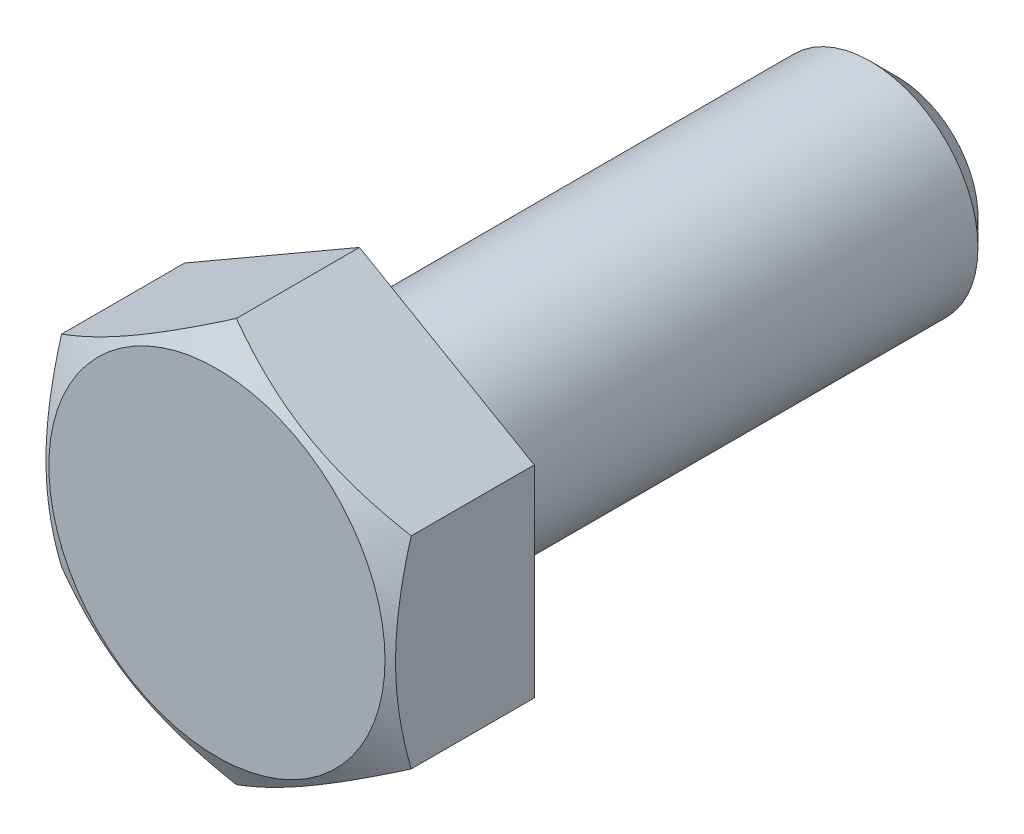
from build123d import *

# Parameters (mm, degrees)
EXTRUDE_1_DEPTH     = 5.3
SKETCH_2_OUTSIDE_W  = 61.562
SKETCH_2_OUTSIDE_H  = 63.574
SKETCH_2_OUTSIDE_R  = 6.25
CUT_EXTRUDE_1_DEPTH = 12.254924848
CUT_EXTRUDE_1_DRAFT = -60
SKETCH_3_R          = 4
EXTRUDE_2_DEPTH     = 20
CHAMFER_1_SIZE      = 1


with BuildPart() as part:
    # Эскиз1 → Бобышка-Вытянуть1 (new body)
    with BuildSketch(Plane.XY):
        Polygon((0, 7.505553499), (-6.5, 3.75277675), (-6.5, -3.75277675), (0, -7.505553499), (6.5, -3.75277675), (6.5, 3.75277675), align=None)
    extrude(amount=EXTRUDE_1_DEPTH)


with BuildPart() as cut_extrude_1_tool:
    # Эскиз2 outside → Вырез-Вытянуть1 (with draft: the straight prism first)
    with BuildSketch(Plane.XY.offset(5.3)):
        Rectangle(SKETCH_2_OUTSIDE_W, SKETCH_2_OUTSIDE_H)
        Circle(SKETCH_2_OUTSIDE_R, mode=Mode.SUBTRACT)
    extrude(amount=-CUT_EXTRUDE_1_DEPTH)
    # Вырез-Вытянуть1: the draft: its side faces are tilted about the plane it starts from
    cut_extrude_1_sides = [cut_extrude_1_tool.faces().sort_by_distance(p)[0] for p in [
        (0, -31.787, -0.827462424),
        (30.781, 0, -0.827462424),
        (0, 31.787, -0.827462424),
        (-30.781, 0, -0.827462424),
        (-6.25, 0, -0.827462424),
    ]]
    draft(cut_extrude_1_sides, Plane.XY.offset(5.3), CUT_EXTRUDE_1_DRAFT)


with BuildPart() as part_1:
    add(part.part)

    # Вырез-Вытянуть1: cut by cut_extrude_1_tool
    add(cut_extrude_1_tool.part, mode=Mode.SUBTRACT)

    # Эскиз3 → Бобышка-Вытянуть2 (add)
    with BuildSketch(Plane(origin=(0, 0, 0), x_dir=(-1, 0, 0), z_dir=(0, 0, -1))):
        with Locations(Location((0, 0, 0), (0, 0, 180))):
            Circle(SKETCH_3_R)
    extrude(amount=EXTRUDE_2_DEPTH)

    # Фаска1
    chamfer_1_edges = [part_1.edges().sort_by_distance(p)[0] for p in [
        (-4, 0, -20),
    ]]
    chamfer(chamfer_1_edges, length=CHAMFER_1_SIZE)


solid = part_1.part
